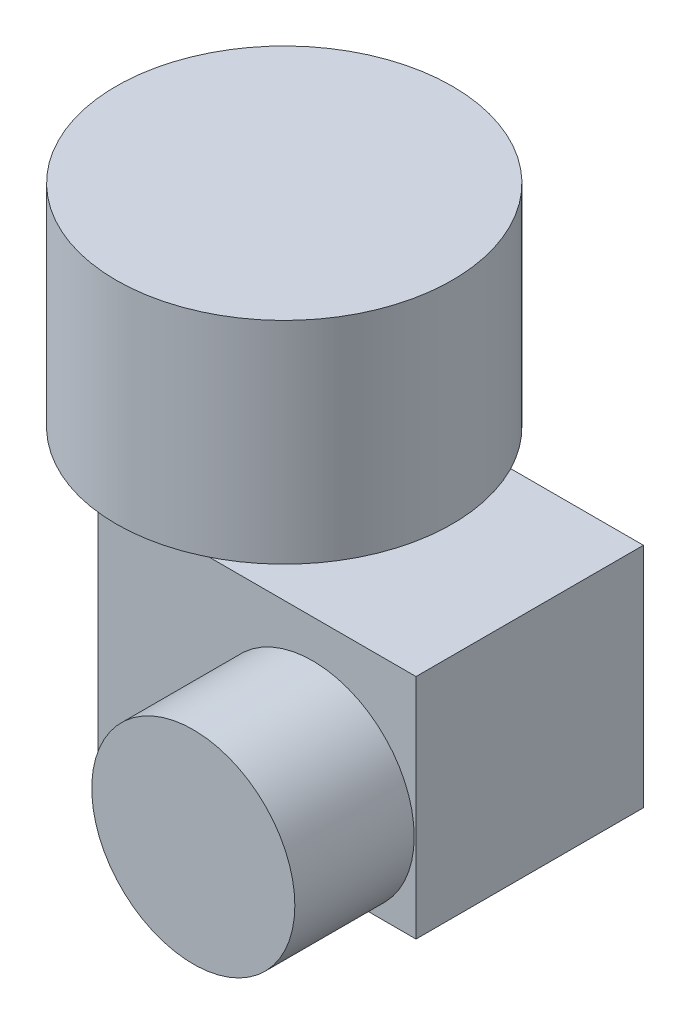
from build123d import *

# Parameters (mm, degrees)
SKETCH1_W           = 22.352
SKETCH1_H           = 22.352
BOSS_EXTRUDE1_DEPTH = 31.242
SKETCH2_R           = 3.81
BOSS_EXTRUDE2_DEPTH = 1.0541
SKETCH3_W           = 8.128
SKETCH3_H           = 8.128
BOSS_EXTRUDE3_DEPTH = 2.54
SKETCH4_R           = 16.5227
BOSS_EXTRUDE4_DEPTH = 20.7518
SKETCH5_R           = 3.81
BOSS_EXTRUDE5_DEPTH = 2.1082
SKETCH6_R           = 6.35
BOSS_EXTRUDE7_DEPTH = 2.54
SKETCH7_R           = 9.9822
BOSS_EXTRUDE8_DEPTH = 11.7348


with BuildPart() as part:
    # Sketch1 → Boss-Extrude1 (new body)
    with BuildSketch(Plane(origin=(0, 0, 0), x_dir=(0, 0, -1), z_dir=(1, 0, 0))):
        with Locations((11.176, 11.176)):
            Rectangle(SKETCH1_W, SKETCH1_H)
    extrude(amount=-BOSS_EXTRUDE1_DEPTH)

    # Sketch2 → Boss-Extrude2 (add)
    with BuildSketch(Plane(origin=(0, 22.352, 0), x_dir=(1, 0, 0), z_dir=(0, 1, 0))):
        with Locations(Location((-24.13, 11.176, 0), (0, 0, 270))):
            Circle(SKETCH2_R)
    extrude(amount=BOSS_EXTRUDE2_DEPTH)

    # Sketch3 → Boss-Extrude3 (add)
    with BuildSketch(Plane(origin=(0, 23.4061, 0), x_dir=(1, 0, 0), z_dir=(0, 1, 0))):
        with Locations((-24.13, 11.176)):
            Rectangle(SKETCH3_W, SKETCH3_H)
    extrude(amount=BOSS_EXTRUDE3_DEPTH)

    # Sketch4 → Boss-Extrude4 (add)
    with BuildSketch(Plane(origin=(0, 25.9461, 0), x_dir=(1, 0, 0), z_dir=(0, 1, 0))):
        with Locations(Location((-24.13, 11.176, 0), (0, 0, 90))):
            Circle(SKETCH4_R)
    extrude(amount=BOSS_EXTRUDE4_DEPTH)

    # Sketch5 → Boss-Extrude5 (add)
    with BuildSketch(Plane.ZY.offset(31.242)):
        with Locations((-11.176, 11.176)):
            Circle(SKETCH5_R)
    extrude(amount=BOSS_EXTRUDE5_DEPTH)

    # Sketch6 → Boss-Extrude7 (add)
    with BuildSketch(Plane.XY):
        with Locations((-7.62, 11.176)):
            Circle(SKETCH6_R)
    extrude(amount=BOSS_EXTRUDE7_DEPTH)

    # Sketch7 → Boss-Extrude8 (add)
    with BuildSketch(Plane.XY.offset(2.54)):
        with Locations((-7.62, 11.176)):
            Circle(SKETCH7_R)
    extrude(amount=BOSS_EXTRUDE8_DEPTH)


solid = part.part
